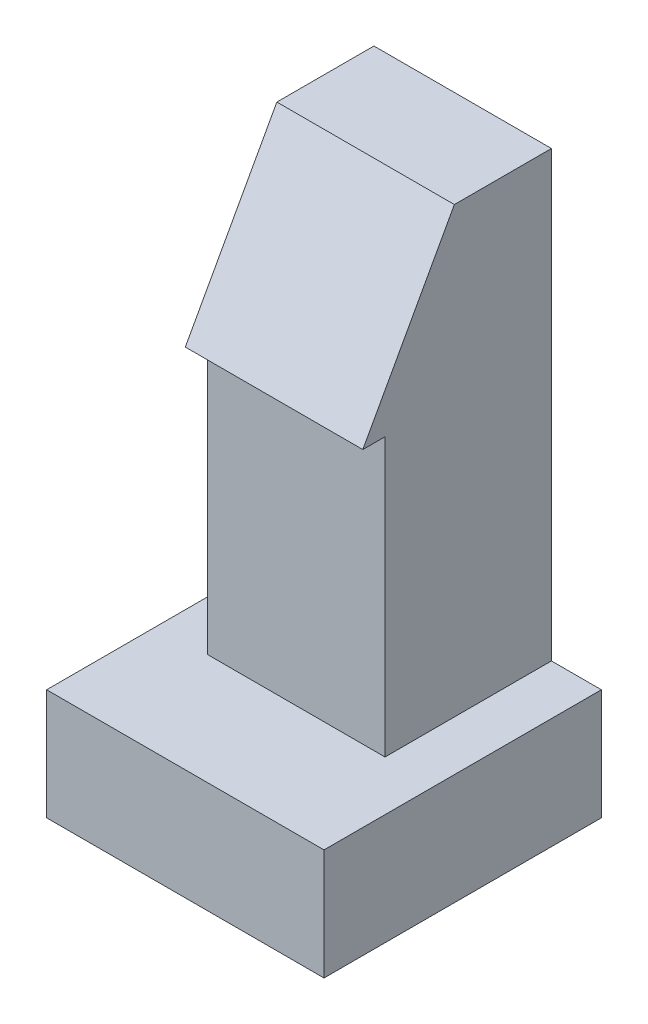
from build123d import *

# Parameters (mm, degrees)
SKETCH1_W           = 5
SKETCH1_H           = 5
BOSS_EXTRUDE1_DEPTH = 2
SKETCH2_W           = 3.2
SKETCH2_H           = 3
BOSS_EXTRUDE2_DEPTH = 5
SKETCH3_W           = 3.2
SKETCH3_H           = 3.4
BOSS_EXTRUDE3_DEPTH = 3
CUT_EXTRUDE1_DEPTH  = 12.093241186


with BuildPart() as part:
    # Sketch1 → Boss-Extrude1 (new body)
    with BuildSketch(Plane(origin=(0, 0, 0), x_dir=(1, 0, 0), z_dir=(0, 1, 0))):
        Rectangle(SKETCH1_W, SKETCH1_H)
    extrude(amount=BOSS_EXTRUDE1_DEPTH)

    # Sketch2 → Boss-Extrude2 (add)
    with BuildSketch(Plane(origin=(0, 2, 0), x_dir=(1, 0, 0), z_dir=(0, 1, 0))):
        with Locations((0, 1)):
            Rectangle(SKETCH2_W, SKETCH2_H)
    extrude(amount=BOSS_EXTRUDE2_DEPTH)

    # Sketch3 → Boss-Extrude3 (add)
    with BuildSketch(Plane(origin=(0, 7, 0), x_dir=(1, 0, 0), z_dir=(0, 1, 0))):
        with Locations((0, 0.8)):
            Rectangle(SKETCH3_W, SKETCH3_H)
    extrude(amount=BOSS_EXTRUDE3_DEPTH)

    # Sketch4 → Cut-Extrude1 (cut, through all)
    with BuildSketch(Plane(origin=(1.6, 0, 0), x_dir=(0, 0, -1), z_dir=(1, 0, 0))):
        Polygon((-0.9, 7), (0.75, 10), (-0.9, 10), align=None)
    extrude(amount=-CUT_EXTRUDE1_DEPTH, mode=Mode.SUBTRACT)


solid = part.part
